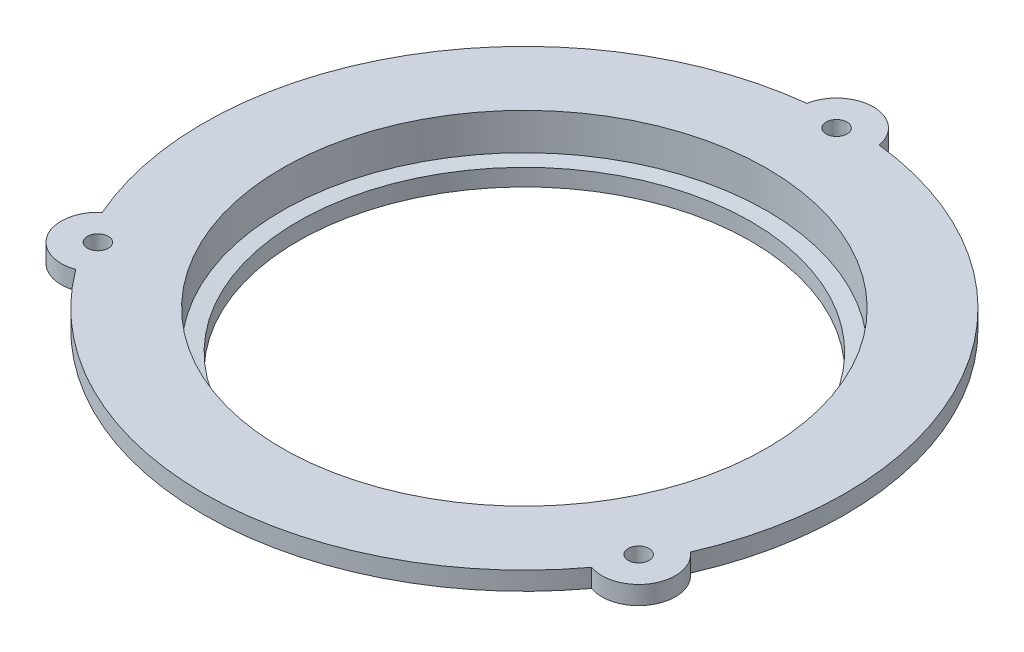
from build123d import *

# Parameters (mm, degrees)
BOSS_EXTRU_2_DEPTH           = 3
D_GAGEMENT_M32_D             = 3.4
R_P_TITION_CIRCULAIRE1_COUNT = 3


with BuildPart() as part:
    # Esquisse1 → Révolution1 (revolve)
    with BuildSketch(Plane.XY, mode=Mode.PRIVATE) as r_volution1_sk:
        with BuildLine():
            Line((-39.6, 5.132876041), (-39.6, -0.867123959))
            ThreePointArc((-39.6, -0.867123959), (-38.300433177, -0.984457181), (-37, -1.091763109))
            Line((-37, -1.091763109), (-37, -3.867123959))
            Line((-37, -3.867123959), (-42, -3.867123959))
            Line((-42, -3.867123959), (-47.4, -0.867123959))
            Line((-47.4, -0.867123959), (-47.4, 2.132876041))
            Line((-47.4, 2.132876041), (-52.4, 2.132876041))
            Line((-52.4, 2.132876041), (-52.4, 5.132876041))
            Line((-52.4, 5.132876041), (-39.6, 5.132876041))
        make_face()
    revolve(r_volution1_sk.sketch.rotate(Axis((0, 0, 0), (0, 1, 0)), 270), axis=Axis((0, 0, 0), (0, 1, 0)))

    # Esquisse2 → Boss.-Extru.2 (add)
    with BuildSketch(Plane(origin=(0, 5.132876041, 0), x_dir=(1, 0, 0), z_dir=(0, 1, 0))):
        with BuildLine():
            Line((-5.904494785, 52.06627451), (0, 51))
            Line((0, 51), (5.904494785, 52.06627451))
            ThreePointArc((5.904494785, 52.06627451), (0, 57), (-5.904494785, 52.06627451))
        make_face()
    boss_extru_2 = extrude(amount=-BOSS_EXTRU_2_DEPTH)

    # Dégagement M32 (through all)
    with Locations(Plane(origin=(0, 5.132876041, 0), x_dir=(1, 0, 0), z_dir=(0, 1, 0))):
        with Locations((0, 51)):
            d_gagement_m32 = Hole(D_GAGEMENT_M32_D / 2)

    # Répétition circulaire1: Boss.-Extru.2, Dégagement M32 ×3 about axis
    r_p_tition_circulaire1_axis = Axis((0, 0, 0), (0, 1, 0))
    add([boss_extru_2.rotate(r_p_tition_circulaire1_axis, i * 360 / R_P_TITION_CIRCULAIRE1_COUNT) for i in range(1, R_P_TITION_CIRCULAIRE1_COUNT)])
    add([d_gagement_m32.rotate(r_p_tition_circulaire1_axis, i * 360 / R_P_TITION_CIRCULAIRE1_COUNT) for i in range(1, R_P_TITION_CIRCULAIRE1_COUNT)], mode=Mode.SUBTRACT)


solid = part.part
